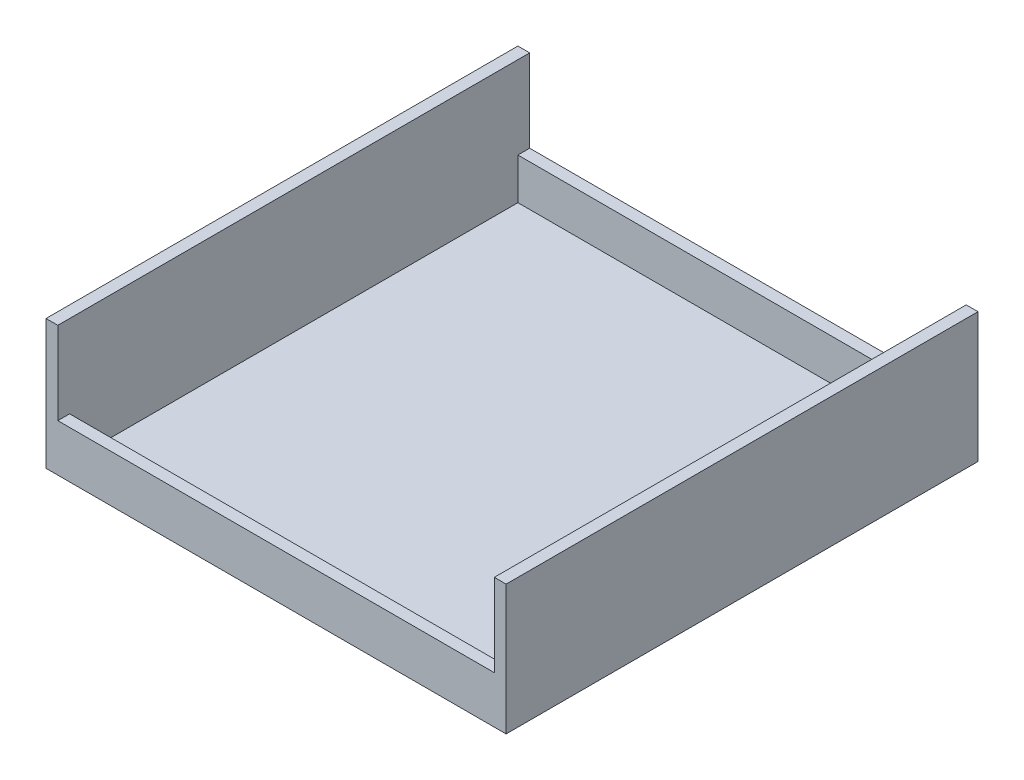
from build123d import *

# Parameters (mm, degrees)
SKETCH2_W           = 78
SKETCH2_H           = 80
BOSS_EXTRUDE1_DEPTH = 1
SKETCH3_W           = 2
SKETCH3_H           = 80
BOSS_EXTRUDE2_DEPTH = 21
SKETCH4_W           = 74
SKETCH4_H           = 2
BOSS_EXTRUDE3_DEPTH = 7


with BuildPart() as part:
    # Sketch2 → Boss-Extrude1 (new body)
    with BuildSketch(Plane(origin=(0, 0, 0), x_dir=(1, 0, 0), z_dir=(0, 1, 0))):
        with Locations((39, 40)):
            Rectangle(SKETCH2_W, SKETCH2_H)
    extrude(amount=BOSS_EXTRUDE1_DEPTH)

    # Sketch3 → Boss-Extrude2 (add)
    with BuildSketch(Plane(origin=(0, 1, 0), x_dir=(1, 0, 0), z_dir=(0, 1, 0))):
        with Locations((1, 40)):
            Rectangle(SKETCH3_W, SKETCH3_H)
        with Locations((77, 40)):
            Rectangle(SKETCH3_W, SKETCH3_H)
    extrude(amount=BOSS_EXTRUDE2_DEPTH)

    # Sketch4 → Boss-Extrude3 (add)
    with BuildSketch(Plane(origin=(0, 1, 0), x_dir=(1, 0, 0), z_dir=(0, 1, 0))):
        with Locations((39, 1)):
            Rectangle(SKETCH4_W, SKETCH4_H)
        with Locations((39, 79)):
            Rectangle(SKETCH4_W, SKETCH4_H)
    extrude(amount=BOSS_EXTRUDE3_DEPTH)


solid = part.part
